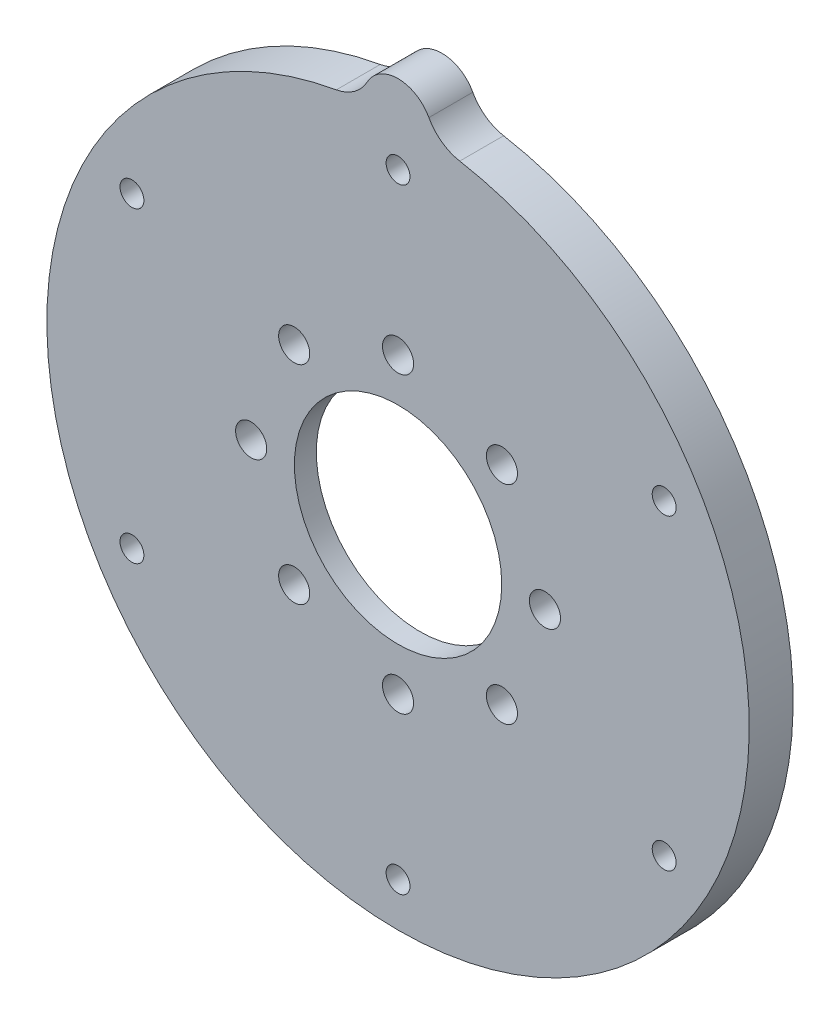
from build123d import *

# Parameters (mm, degrees)
SKETCH1_R             = 50.8
SKETCH1_R_2           = 15
BOSS_EXTRUDE1_DEPTH   = 6.35
CIRPATTERN1_COUNT     = 8
SKETCH5_R             = 41.25
CUT_EXTRUDE1_DEPTH    = 3.175
CHAMFER1_SIZE         = 0.7874
F_8_32_TAPPED_HOLE1_D = 3.4544
CIRPATTERN2_COUNT     = 6
BOSS_EXTRUDE3_START   = -6.35
BOSS_EXTRUDE3_DEPTH   = 6.35
FILLET2_R             = 6.35


with BuildPart() as part:
    # Sketch1 → Boss-Extrude1 (new body)
    with BuildSketch(Plane.XY):
        Circle(SKETCH1_R)
        Circle(SKETCH1_R_2, mode=Mode.SUBTRACT)
    extrude(amount=BOSS_EXTRUDE1_DEPTH)

    # Sketch4 → M4 Clearance Hole1 (revolve, cut)
    with BuildSketch(Plane(origin=(0, 21.249999918, 6.35), x_dir=(0, -1, 0), z_dir=(1, 0, 0))):
        Polygon((0, 0), (0, 26.751936393), (2.25, 25.4), (2.25, 0), align=None)
    m4_clearance_hole1 = revolve(axis=Axis((0, 21.249999918, 12.7), (0, 0, -1)), mode=Mode.SUBTRACT)

    # CirPattern1: M4 Clearance Hole1 ×8 about axis
    cirpattern1_axis = Axis((0, 0, 0), (0, 0, 1))
    for i in range(1, CIRPATTERN1_COUNT):
        add(m4_clearance_hole1.rotate(cirpattern1_axis, i * 360 / CIRPATTERN1_COUNT), mode=Mode.SUBTRACT)

    # Sketch5 → Cut-Extrude1 (cut)
    with BuildSketch(Plane(origin=(0, 0, 0), x_dir=(-1, 0, 0), z_dir=(0, 0, -1))):
        Circle(SKETCH5_R)
    extrude(amount=-CUT_EXTRUDE1_DEPTH, mode=Mode.SUBTRACT)

    # Chamfer1
    chamfer1_edges = [part.edges().sort_by_distance(p)[0] for p in [
        (41.25, 0, 0),
    ]]
    chamfer(chamfer1_edges, length=CHAMFER1_SIZE)

    # #8-32 Tapped Hole1 (through all)
    with Locations(Plane.XY.offset(6.35)):
        with Locations((0, 44.45)):
            f_8_32_tapped_hole1 = Hole(F_8_32_TAPPED_HOLE1_D / 2)

    # CirPattern2: #8-32 Tapped Hole1 ×6 about axis
    cirpattern2_axis = Axis((0, 0, 0), (0, 0, 1))
    for i in range(1, CIRPATTERN2_COUNT):
        add(f_8_32_tapped_hole1.rotate(cirpattern2_axis, i * 360 / CIRPATTERN2_COUNT), mode=Mode.SUBTRACT)

    # Sketch10 → Boss-Extrude3 (add)
    with BuildSketch(Plane.XY.offset(6.35).offset(BOSS_EXTRUDE3_START)):
        with BuildLine():
            ThreePointArc((5.073646026, 50.546), (0, 55.88), (-5.073646026, 50.546))
            ThreePointArc((-5.073646026, 50.546), (0, 50.8), (5.073646026, 50.546))
        make_face()
    extrude(amount=BOSS_EXTRUDE3_DEPTH)

    # Fillet2
    fillet2_edges = [part.edges().sort_by_distance(p)[0] for p in [
        (5.073646026, 50.546, 3.175),
        (-5.073646026, 50.546, 3.175),
    ]]
    fillet(fillet2_edges, radius=FILLET2_R)


solid = part.part
